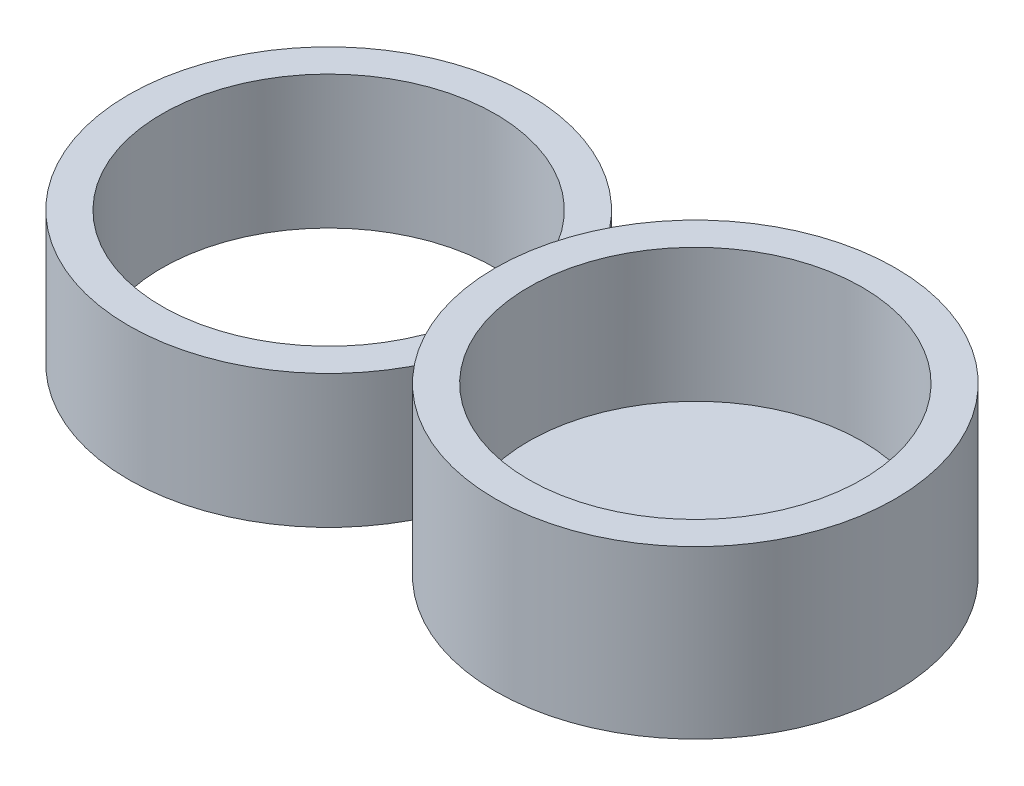
from build123d import *

# Parameters (mm, degrees)
SKETCH_1_R      = 5
EXTRUDE_1_DEPTH = 4
SKETCH_2_R      = 6
EXTRUDE_2_DEPTH = 1
SKETCH_4_R      = 6
SKETCH_4_R_2    = 5
EXTRUDE_3_DEPTH = 1


with BuildPart() as part:
    # Эскиз1 → Бобышка-Вытянуть1 (new body)
    with BuildSketch(Plane(origin=(0, 0, 0), x_dir=(1, 0, 0), z_dir=(0, 1, 0))):
        with BuildLine():
            ThreePointArc((-5.5, -2.397915762), (6, 0), (-5.5, 2.397915762))
            ThreePointArc((-5.5, 2.397915762), (-17, 0), (-5.5, -2.397915762))
        make_face()
        with Locations(Location((0, 0, 0), (0, 0, 270))):
            Circle(SKETCH_1_R, mode=Mode.SUBTRACT)
        with Locations(Location((-11, 0, 0), (0, 0, 270))):
            Circle(SKETCH_1_R, mode=Mode.SUBTRACT)
    extrude(amount=EXTRUDE_1_DEPTH)

    # Эскиз2 → Бобышка-Вытянуть2 (add)
    with BuildSketch(Plane.XZ):
        Circle(SKETCH_2_R)
    extrude(amount=-EXTRUDE_2_DEPTH)

    # Эскиз4 → Бобышка-Вытянуть3 (add)
    with BuildSketch(Plane(origin=(0, 4, 0), x_dir=(1, 0, 0), z_dir=(0, 1, 0))):
        with Locations(Location((0, 0, 0), (0, 0, 156.443535691))):
            Circle(SKETCH_4_R)
        with Locations(Location((0, 0, 0), (0, 0, 90))):
            Circle(SKETCH_4_R_2, mode=Mode.SUBTRACT)
    extrude(amount=EXTRUDE_3_DEPTH)


solid = part.part
